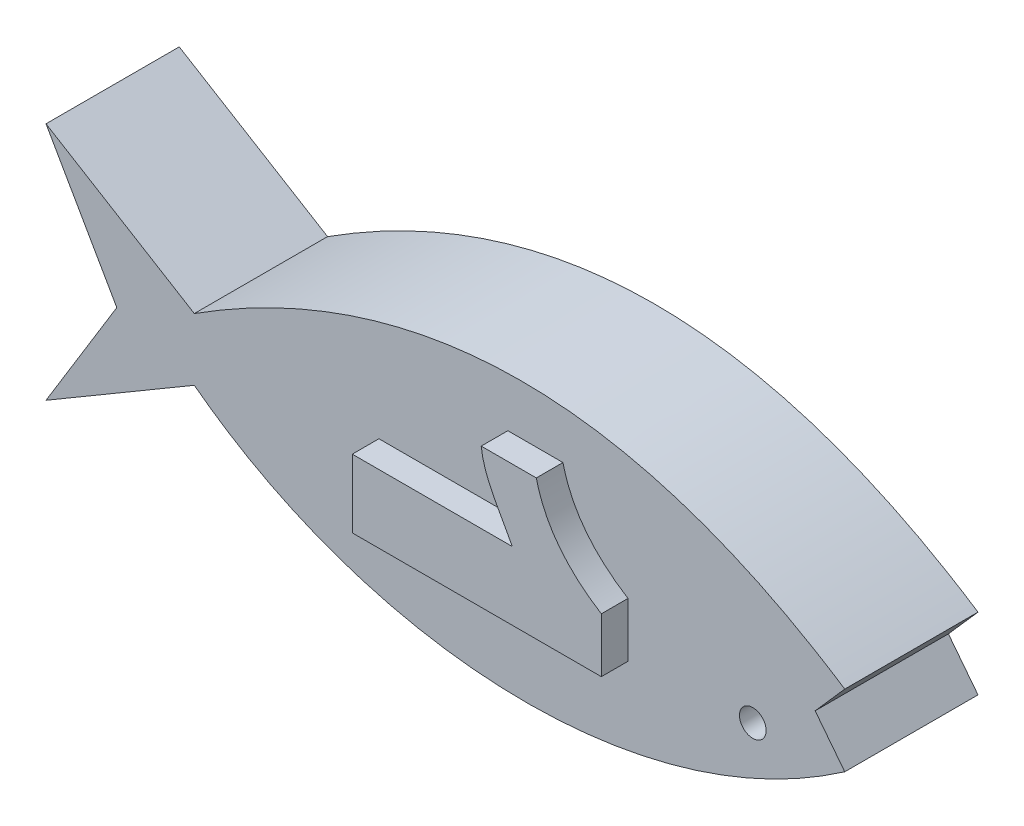
from build123d import *

# Parameters (mm, degrees)
SKETCH2_R           = 0.500109693
BOSS_EXTRUDE1_DEPTH = 5
BOSS_EXTRUDE2_DEPTH = 1


with BuildPart() as part:
    # Sketch2 → Boss-Extrude1 (new body)
    with BuildSketch(Plane(origin=(0, 0, 0), x_dir=(1, 0, 0), z_dir=(0, 0, -1))):
        with BuildLine():
            Line((29.97295835, 6.642737104), (28.862437793, 5.215722686))
            Line((28.862437793, 5.215722686), (29.97295835, 3.953817374))
            add(Edge.make_bspline(
                [(5.565346412, 3.953817374), (17.919076804, -3.939717318), (29.97295835, 3.953817374)],
                knots=[0, 0, 0, 1, 1, 1], degree=2))
            Line((5.565346412, 3.953817374), (0, 0.570103483))
            Line((0, 0.570103483), (2.65645961, 5.215722686))
            Line((2.65645961, 5.215722686), (0, 9.556126627))
            Line((0, 9.556126627), (5.565346412, 6.285726684))
            add(Edge.make_bspline(
                [(5.565346412, 6.285726684), (12.037313538, 11.217277608), (22.14175538, 12.07873787), (29.97295835, 6.642737104)],
                knots=[0, 0, 0, 0, 1, 1, 1, 1], degree=3))
        make_face()
        with Locations(Location((26.5225963, 6.780666166, 0), (0, 0, 180))):
            Circle(SKETCH2_R, mode=Mode.SUBTRACT)
    extrude(amount=-BOSS_EXTRUDE1_DEPTH)

    # Sketch4 → Boss-Extrude2 (add)
    with BuildSketch(Plane(origin=(0, 0, 5), x_dir=(-1, 0, 0), z_dir=(0, 0, 1))):
        with BuildLine():
            Line((-17.330711562, 1.879075557), (-19.398244519, 1.879075557))
            add(Edge.make_bspline(
                [(-19.398244519, 1.879075557), (-19.857893705, 3.836469275), (-21.838627479, 5.07519839)],
                knots=[0, 0, 0, 1, 1, 1], degree=2))
            Line((-21.838627479, 5.07519839), (-21.838627479, 7.118264722))
            Line((-21.838627479, 7.118264722), (-12.493271281, 7.118264722))
            Line((-12.493271281, 7.118264722), (-12.493271281, 4.559250574))
            Line((-12.493271281, 4.559250574), (-18.4990791, 4.559250574))
            add(Edge.make_bspline(
                [(-18.4990791, 4.559250574), (-18.040909727, 3.659817697), (-17.443363766, 2.880283759), (-17.330711562, 1.879075557)],
                knots=[0, 0, 0, 0, 1, 1, 1, 1], degree=3))
        make_face()
    extrude(amount=BOSS_EXTRUDE2_DEPTH)


solid = part.part
